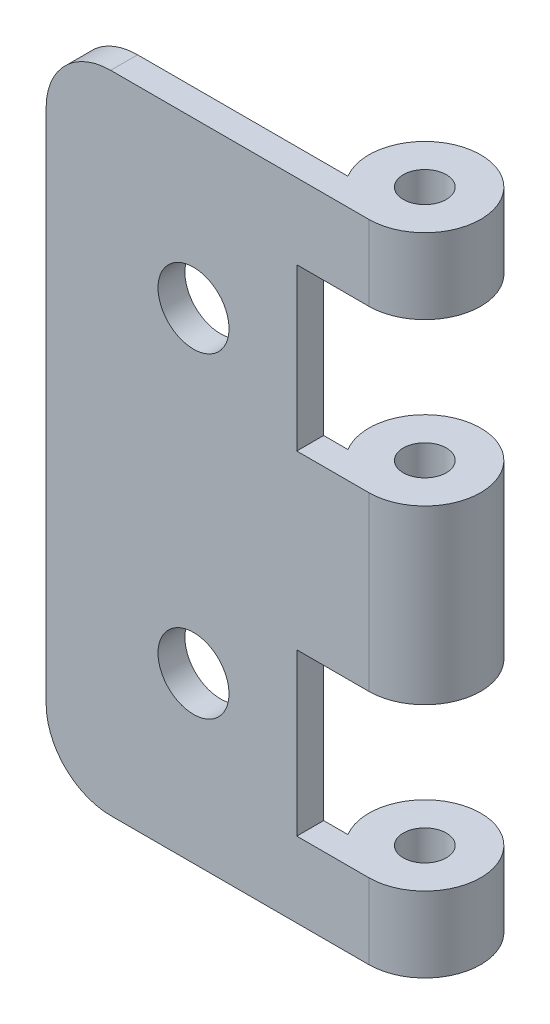
from build123d import *

# Parameters (mm, degrees)
BOSS_EXTRUDE1_DEPTH = 76.2
SKETCH2_R           = 4.191
CUT_EXTRUDE1_DEPTH  = 50.8
CUT_EXTRUDE2_START  = 8.89
CUT_EXTRUDE2_DEPTH  = 19.05
CUT_EXTRUDE3_START  = 48.26
CUT_EXTRUDE3_DEPTH  = 19.05
SKETCH3_R           = 2.54
CUT_EXTRUDE4_DEPTH  = 90.327145258
FILLET1_R           = 7.62
FILLET2_R           = 7.62


with BuildPart() as part:
    # Sketch1 → Boss-Extrude1 (new body)
    with BuildSketch(Plane(origin=(0, 0, 0), x_dir=(1, 0, 0), z_dir=(0, 1, 0))):
        with BuildLine():
            Line((0, 0), (38.1, 0))
            ThreePointArc((38.1, 0), (41.337877391, 12.35977675), (32.455996545, 3.175))
            Line((32.455996545, 3.175), (0, 3.175))
            Line((0, 3.175), (0, 0))
        make_face()
    extrude(amount=BOSS_EXTRUDE1_DEPTH)

    # Sketch2 → Cut-Extrude1 (cut)
    with BuildSketch(Plane(origin=(0, 0, -3.175), x_dir=(-1, 0, 0), z_dir=(0, 0, -1))):
        with Locations((-17.399, 56.769)):
            Circle(SKETCH2_R)
        with Locations((-17.399, 19.431)):
            Circle(SKETCH2_R)
    extrude(amount=-CUT_EXTRUDE1_DEPTH, mode=Mode.SUBTRACT)

    # Sketch1<3> → Cut-Extrude2 (cut)
    with BuildSketch(Plane(origin=(0, 0, 0), x_dir=(1, 0, 0), z_dir=(0, 1, 0)).offset(CUT_EXTRUDE2_START)):
        with BuildLine():
            Line((32.455996545, 3.175), (29.591, 3.175))
            Line((29.591, 3.175), (29.591, 0))
            Line((29.591, 0), (38.1, 0))
            ThreePointArc((38.1, 0), (41.337877391, 12.35977675), (32.455996545, 3.175))
        make_face()
    extrude(amount=CUT_EXTRUDE2_DEPTH, mode=Mode.SUBTRACT)

    # Sketch1<5> → Cut-Extrude3 (cut)
    with BuildSketch(Plane(origin=(0, 0, 0), x_dir=(1, 0, 0), z_dir=(0, 1, 0)).offset(CUT_EXTRUDE3_START)):
        with BuildLine():
            Line((32.455996545, 3.175), (29.591, 3.175))
            Line((29.591, 3.175), (29.591, 0))
            Line((29.591, 0), (38.1, 0))
            ThreePointArc((38.1, 0), (41.337877391, 12.35977675), (32.455996545, 3.175))
        make_face()
    extrude(amount=CUT_EXTRUDE3_DEPTH, mode=Mode.SUBTRACT)

    # Sketch3 → Cut-Extrude4 (cut, through all)
    with BuildSketch(Plane(origin=(0, 76.2, 0), x_dir=(1, 0, 0), z_dir=(0, 1, 0))):
        with Locations((38.1, 6.604)):
            Circle(SKETCH3_R)
    extrude(amount=-CUT_EXTRUDE4_DEPTH, mode=Mode.SUBTRACT)

    # Fillet1
    fillet1_edges = [part.edges().sort_by_distance(p)[0] for p in [
        (0, 0, -1.5875),
    ]]
    fillet(fillet1_edges, radius=FILLET1_R)

    # Fillet2
    fillet2_edges = [part.edges().sort_by_distance(p)[0] for p in [
        (0, 76.2, -1.5875),
    ]]
    fillet(fillet2_edges, radius=FILLET2_R)


solid = part.part
